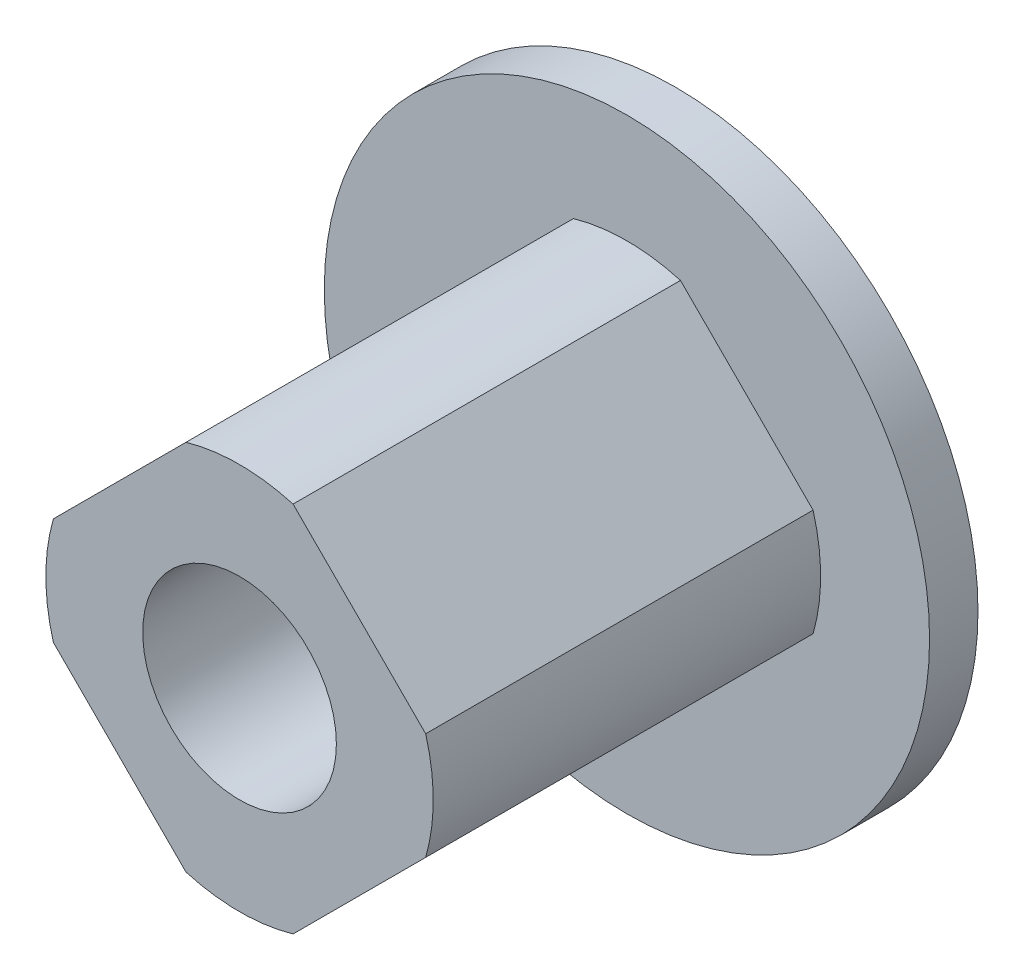
from build123d import *

# Parameters (mm, degrees)
SKETCH1_R           = 12.7
SKETCH1_R_2         = 6.35
BOSS_EXTRUDE1_DEPTH = 3.175
SKETCH2_R           = 19.84375
SKETCH2_R_2         = 6.35
BOSS_EXTRUDE2_DEPTH = 3.175
SKETCH3_R           = 12.7
SKETCH3_R_2         = 6.35
BOSS_EXTRUDE3_DEPTH = 25.4
SKETCH4_W           = 3.175
SKETCH4_H           = 9.525
CUT_EXTRUDE1_DEPTH  = 22.225
SKETCH5_R           = 23.837000359
CUT_EXTRUDE2_DEPTH  = 25.4


with BuildPart() as part:
    # Sketch1 → Boss-Extrude1 (new body)
    with BuildSketch(Plane.XY):
        Circle(SKETCH1_R)
        Circle(SKETCH1_R_2, mode=Mode.SUBTRACT)
    extrude(amount=BOSS_EXTRUDE1_DEPTH)

    # Sketch2 → Boss-Extrude2 (add)
    with BuildSketch(Plane.XY.offset(3.175)):
        Circle(SKETCH2_R)
        Circle(SKETCH2_R_2, mode=Mode.SUBTRACT)
    extrude(amount=BOSS_EXTRUDE2_DEPTH)

    # Sketch3 → Boss-Extrude3 (add)
    with BuildSketch(Plane.XY.offset(6.35)):
        Circle(SKETCH3_R)
        Circle(SKETCH3_R_2, mode=Mode.SUBTRACT)
    extrude(amount=BOSS_EXTRUDE3_DEPTH)

    # Sketch4 → Cut-Extrude1 (cut)
    with BuildSketch(Plane(origin=(0, 0, 0), x_dir=(-1, 0, 0), z_dir=(0, 0, -1))):
        with Locations((0, 4.7625)):
            Rectangle(SKETCH4_W, SKETCH4_H)
    extrude(amount=-CUT_EXTRUDE1_DEPTH, mode=Mode.SUBTRACT)

    # Sketch5 → Cut-Extrude2 (cut)
    with BuildSketch(Plane.XY.offset(31.75)):
        Circle(SKETCH5_R)
        Polygon((0, 15.715448212), (-15.715448212, 0), (0, -15.715448212), (15.715448212, 0), align=None, mode=Mode.SUBTRACT)
    extrude(amount=-CUT_EXTRUDE2_DEPTH, mode=Mode.SUBTRACT)


solid = part.part
